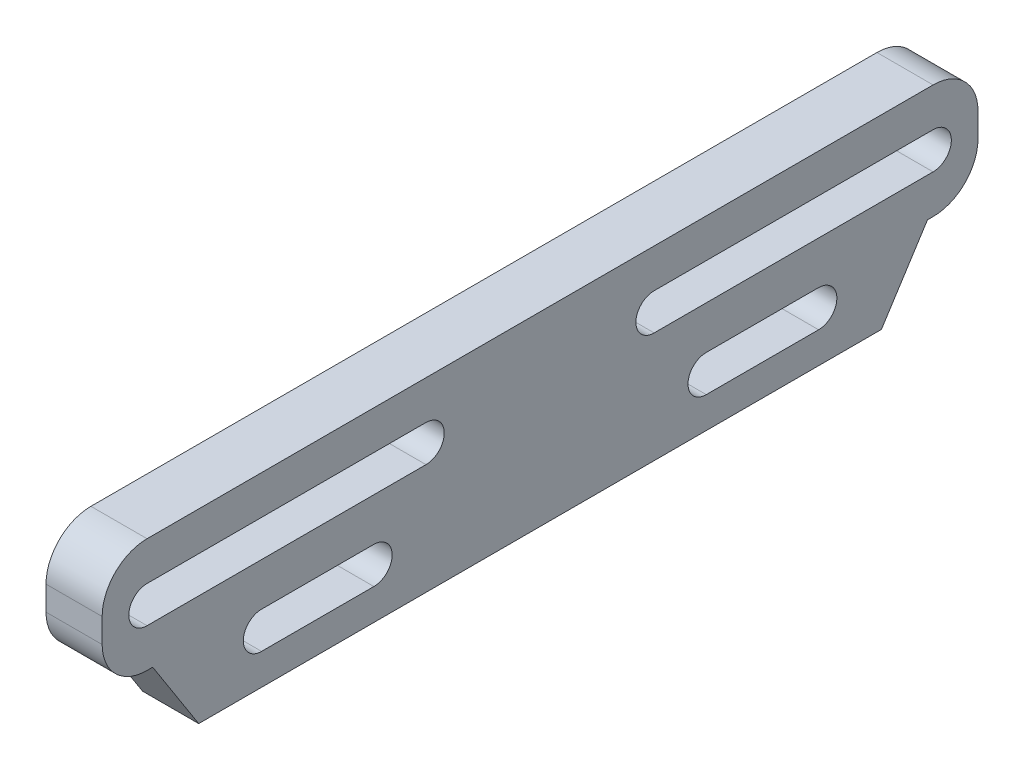
from build123d import *

# Parameters (mm, degrees)
BOSS_EXTRU_1_DEPTH      = 97.5
BOSS_EXTRU_1_DEPTH_BACK = 97.5
ESQUISSE1_W             = 12.5
ESQUISSE1_H             = 25.4
ENL_V_MAT_EXTRU_1_DEPTH = 102.526646749
CONG_1_R                = 10
CONG_2_R                = 10
CONG_3_R                = 10
CONG_4_R                = 10
BOSS_EXTRU_4_DEPTH      = 12.5
ENL_V_MAT_EXTRU_2_DEPTH = 102.526646749


with BuildPart() as part:
    # Esquisse1 → Boss.-Extru.1 (new, two sides: drawn at the far end of the back side and taken through both)
    with BuildSketch(Plane.XY.offset(-BOSS_EXTRU_1_DEPTH_BACK)):
        with Locations((6.25, 12.7)):
            Rectangle(ESQUISSE1_W, ESQUISSE1_H)
    extrude(amount=BOSS_EXTRU_1_DEPTH + BOSS_EXTRU_1_DEPTH_BACK)

    # Esquisse3 → Enlèv. mat.-Extru.1 (cut, through all)
    with BuildSketch(Plane.ZY):
        with BuildLine():
            Line((25.4, 16.765), (87.5, 16.765))
            ThreePointArc((87.5, 16.765), (91.565, 12.7), (87.5, 8.635))
            Line((87.5, 8.635), (25.4, 8.635))
            ThreePointArc((25.4, 8.635), (21.335, 12.7), (25.4, 16.765))
        make_face()
    enl_v_mat_extru_1 = extrude(amount=-ENL_V_MAT_EXTRU_1_DEPTH, mode=Mode.SUBTRACT)

    # Symétrie1: Enlèv. mat.-Extru.1 across plane
    add(enl_v_mat_extru_1.mirror(Plane.XY), mode=Mode.SUBTRACT)

    # Congé1
    cong_1_edges = [part.edges().sort_by_distance(p)[0] for p in [
        (6.25, 0, -97.5),
    ]]
    fillet(cong_1_edges, radius=CONG_1_R)

    # Congé2
    cong_2_edges = [part.edges().sort_by_distance(p)[0] for p in [
        (6.25, 25.4, -97.5),
    ]]
    fillet(cong_2_edges, radius=CONG_2_R)

    # Congé3
    cong_3_edges = [part.edges().sort_by_distance(p)[0] for p in [
        (6.25, 0, 97.5),
    ]]
    fillet(cong_3_edges, radius=CONG_3_R)

    # Congé4
    cong_4_edges = [part.edges().sort_by_distance(p)[0] for p in [
        (6.25, 25.4, 97.5),
    ]]
    fillet(cong_4_edges, radius=CONG_4_R)

    # Esquisse4 → Boss.-Extru.4 (add)
    with BuildSketch(Plane(origin=(12.5, 0, 0), x_dir=(0, 0, -1), z_dir=(1, 0, 0))):
        Polygon((0, 0), (-56.566309771, 0), (-86.246950766, 0), (-76, -16), (0, -16), (76, -16), (86.246950766, 0), (56.566309771, 0), align=None)
    extrude(amount=-BOSS_EXTRU_4_DEPTH)

    # Esquisse5 → Enlèv. mat.-Extru.2 (cut, through all)
    with BuildSketch(Plane(origin=(12.5, 0, 0), x_dir=(0, 0, -1), z_dir=(1, 0, 0))):
        with BuildLine():
            Line((-62.01, -0.935), (-37, -0.935))
            ThreePointArc((-37, -0.935), (-32.935, -5), (-37, -9.065))
            Line((-37, -9.065), (-62.01, -9.065))
            ThreePointArc((-62.01, -9.065), (-66.075, -5), (-62.01, -0.935))
        make_face()
    enl_v_mat_extru_2 = extrude(amount=-ENL_V_MAT_EXTRU_2_DEPTH, mode=Mode.SUBTRACT)

    # Symétrie2: Enlèv. mat.-Extru.2 across plane
    add(enl_v_mat_extru_2.mirror(Plane.XY), mode=Mode.SUBTRACT)


solid = part.part
